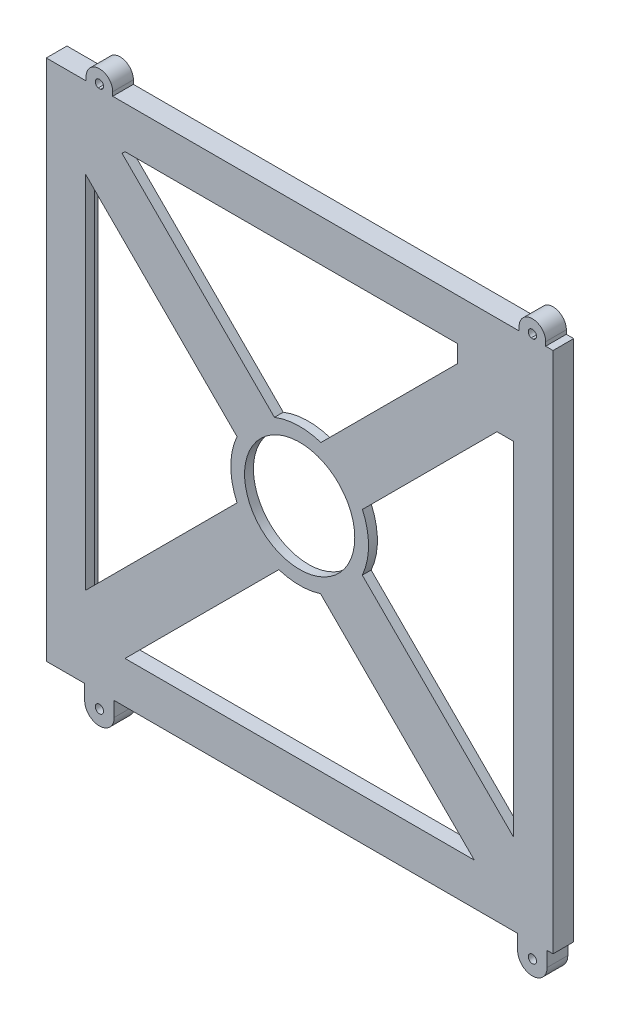
from build123d import *

# Parameters (mm, degrees)
BOSS_EXTRU_1_DEPTH      = 5
BOSS_EXTRU_1_2_DEPTH    = 5
BOSS_EXTRU_1_3_DEPTH    = 5
BOSS_EXTRU_1_4_DEPTH    = 5
BOSS_EXTRU_2_DEPTH      = 3
ENL_V_MAT_EXTRU_2_DEPTH = 186.027362841
ESQUISSE4_R             = 1.6
BOSS_EXTRU_3_DEPTH      = 3
BOSS_EXTRU_4_DEPTH      = 183.014563107
BOSS_EXTRU_6_DEPTH      = 169.006591337
BOSS_EXTRU_7_DEPTH      = 174.257281553
BOSS_EXTRU_8_DEPTH      = 177.5
ESQUISSE10_R            = 28
BOSS_EXTRU_9_DEPTH      = 2
BOSS_EXTRU_11_START     = 2.5
ESQUISSE11_W            = 257.5
ESQUISSE11_H            = 265.5
ESQUISSE11_R            = 28
BOSS_EXTRU_11_DEPTH     = 2.5
ESQUISSE12_R            = 2.1
BOSS_EXTRU_12_DEPTH     = 10.5
ESQUISSE13_R            = 5.1
ENL_V_MAT_EXTRU_3_DEPTH = 5
BOSS_EXTRU_13_DEPTH     = 10.5
ESQUISSE15_R            = 5.1
ENL_V_MAT_EXTRU_4_DEPTH = 5
CONG_1_R                = 1


with BuildPart() as part:
    # Esquisse1 → Boss.-Extru.1 (new body)
    with BuildSketch(Plane.XY):
        Polygon((128.75, -132.75), (88.75, -132.75), (88.75, -111.507281553), (108.75, -91.507281553), (128.75, -91.507281553), align=None)
    extrude(amount=BOSS_EXTRU_1_DEPTH)



with BuildPart() as body_2:
    # Esquisse1 → Boss.-Extru.1 2 (new body)
    with BuildSketch(Plane.XY):
        Polygon((128.75, 132.75), (80.256591337, 132.75), (80.256591337, 102.75), (100.256591337, 82.75), (128.75, 82.75), align=None)
    extrude(amount=BOSS_EXTRU_1_2_DEPTH)


with BuildPart() as body_3:
    # Esquisse1 → Boss.-Extru.1 3 (new body)
    with BuildSketch(Plane.XY):
        Polygon((-128.75, -132.75), (-128.75, -91.507281553), (-108.75, -91.507281553), (-88.75, -111.507281553), (-88.75, -132.75), align=None)
    extrude(amount=BOSS_EXTRU_1_3_DEPTH)


with BuildPart() as body_4:
    # Esquisse1 → Boss.-Extru.1 4 (new body)
    with BuildSketch(Plane.XY):
        Polygon((-88.75, 132.75), (-88.75, 111.507281553), (-108.75, 91.507281553), (-128.75, 91.507281553), (-128.75, 132.75), align=None)
    extrude(amount=BOSS_EXTRU_1_4_DEPTH)


with BuildPart() as part_1:
    add(part.part)

    add(body_2.part)  # Boss.-Extru.2 merges body 2

    add(body_3.part)  # Boss.-Extru.2 merges body 3

    add(body_4.part)  # Boss.-Extru.2 merges body 4
    # Esquisse2 → Boss.-Extru.2 (add)
    with BuildSketch(Plane(origin=(0, 0, 0), x_dir=(-1, 0, 0), z_dir=(0, 0, -1))):
        Polygon((-80.256591337, 127.75), (-80.256591337, 132.75), (-128.75, 132.75), (-128.75, 82.75), (-123.75, 82.75), (-123.75, 127.75), align=None)
        Polygon((-123.75, -127.75), (-88.75, -127.75), (-88.75, -132.75), (-128.75, -132.75), (-128.75, -91.507281553), (-123.75, -91.507281553), align=None)
        Polygon((88.75, -127.75), (88.75, -132.75), (128.75, -132.75), (128.75, -91.507281553), (123.75, -91.507281553), (123.75, -127.75), align=None)
        Polygon((128.75, 132.75), (88.75, 132.75), (88.75, 127.75), (123.75, 127.75), (123.75, 91.507281553), (128.75, 91.507281553), align=None)
    extrude(amount=BOSS_EXTRU_2_DEPTH)

    # Esquisse3 → Enlèv. mat.-Extru.2 (cut, through all)
    with BuildSketch(Plane.XY.offset(3)):
        Polygon((110, 82.75), (110, 110), (80.256591337, 110), (80.256591337, 102.75), (100.256591337, 82.75), align=None)
        Polygon((-90.257281553, 110), (-110, 110), (-110, 91.507281553), (-108.75, 91.507281553), align=None)
        Polygon((-110, -110), (-110, -91.507281553), (-108.75, -91.507281553), (-90.257281553, -110), align=None)
        Polygon((110, -91.507281553), (110, -110), (90.257281553, -110), (108.75, -91.507281553), align=None)
    extrude(amount=-ENL_V_MAT_EXTRU_2_DEPTH, mode=Mode.SUBTRACT)

    # Esquisse4 → Boss.-Extru.3 (add)
    with BuildSketch(Plane(origin=(0, 0, 3), x_dir=(-1, 0, 0), z_dir=(0, 0, -1))):
        with Locations(Location((-107.5, 107.5, 0), (0, 0, 180))):
            Circle(ESQUISSE4_R)
        with Locations((-107.5, -107.5)):
            Circle(ESQUISSE4_R)
        with Locations(Location((107.5, -107.5, 0), (0, 0, 180))):
            Circle(ESQUISSE4_R)
        with Locations(Location((107.5, 107.5, 0), (0, 0, 180))):
            Circle(ESQUISSE4_R)
    extrude(amount=BOSS_EXTRU_3_DEPTH)

    # Esquisse5 → Boss.-Extru.4 (add)
    with BuildSketch(Plane.XZ.offset(-91.507281553)):
        Polygon((-123.75, 0), (-110, 0), (-110, 3), (-108.75, 3), (-108.75, 5), (-128.75, 5), (-128.75, -3), (-123.75, -3), align=None)
    extrude(amount=BOSS_EXTRU_4_DEPTH)

    # Esquisse7 → Boss.-Extru.6 (add)
    with BuildSketch(Plane(origin=(-88.75, 0, 0), x_dir=(0, 0, -1), z_dir=(1, 0, 0))):
        Polygon((0, 111.507281553), (0, 127.75), (3, 127.75), (3, 132.75), (-5, 132.75), (-5, 111.507281553), align=None)
    extrude(amount=BOSS_EXTRU_6_DEPTH)

    # Esquisse8 → Boss.-Extru.7 (add)
    with BuildSketch(Plane(origin=(0, -91.507281553, 0), x_dir=(1, 0, 0), z_dir=(0, 1, 0))):
        Polygon((123.75, 0), (110, 0), (110, -3), (108.75, -3), (108.75, -5), (128.75, -5), (128.75, 3), (123.75, 3), align=None)
    extrude(amount=BOSS_EXTRU_7_DEPTH)

    # Esquisse9 → Boss.-Extru.8 (add)
    with BuildSketch(Plane.ZY.offset(-88.75)):
        Polygon((0, -111.507281553), (0, -127.75), (-3, -127.75), (-3, -132.75), (5, -132.75), (5, -111.507281553), align=None)
    extrude(amount=BOSS_EXTRU_8_DEPTH)

    # Esquisse10 → Boss.-Extru.9 (add)
    with BuildSketch(Plane.XY.offset(5)):
        with BuildLine():
            Line((100.256591337, 82.75), (31.902373727, 14.39578239))
            ThreePointArc((31.902373727, 14.39578239), (34.999858189, -0.099633105), (31.819897219, -14.577178773))
            Line((31.819897219, -14.577178773), (108.75, -91.507281553))
            Line((108.75, -91.507281553), (88.75, -111.507281553))
            Line((88.75, -111.507281553), (10.599223862, -33.356505415))
            ThreePointArc((10.599223862, -33.356505415), (0, -35), (-10.599223862, -33.356505415))
            Line((-10.599223862, -33.356505415), (-88.75, -111.507281553))
            Line((-88.75, -111.507281553), (-108.75, -91.507281553))
            Line((-108.75, -91.507281553), (-31.819897219, -14.577178773))
            ThreePointArc((-31.819897219, -14.577178773), (-35, 0), (-31.819897219, 14.577178773))
            Line((-31.819897219, 14.577178773), (-108.75, 91.507281553))
            Line((-108.75, 91.507281553), (-90.257281553, 110))
            Line((-90.257281553, 110), (-12.823491891, 32.566210337))
            ThreePointArc((-12.823491891, 32.566210337), (-1.075408771, 34.983474613), (10.798967391, 33.292376054))
            Line((10.798967391, 33.292376054), (80.256591337, 102.75))
            Line((80.256591337, 102.75), (100.256591337, 82.75))
        make_face()
        Circle(ESQUISSE10_R, mode=Mode.SUBTRACT)
    extrude(amount=-BOSS_EXTRU_9_DEPTH)

    # Esquisse11 → Boss.-Extru.11 (add)
    with BuildSketch(Plane.XY.offset(5).offset(BOSS_EXTRU_11_START)):
        Rectangle(ESQUISSE11_W, ESQUISSE11_H)
        Circle(ESQUISSE11_R, mode=Mode.SUBTRACT)
        with BuildLine():
            Line((80.256591337, 111.507281553), (80.256591337, 102.75))
            Line((80.256591337, 102.75), (10.798967391, 33.292376054))
            ThreePointArc((10.798967391, 33.292376054), (-1.075408771, 34.983474613), (-12.823491891, 32.566210337))
            Line((-12.823491891, 32.566210337), (-90.257281553, 110))
            Line((-90.257281553, 110), (-88.75, 111.507281553))
            Line((-88.75, 111.507281553), (80.256591337, 111.507281553))
        make_face(mode=Mode.SUBTRACT)
        with BuildLine():
            Line((-108.75, 91.507281553), (-31.819897219, 14.577178773))
            ThreePointArc((-31.819897219, 14.577178773), (-35, 0), (-31.819897219, -14.577178773))
            Line((-31.819897219, -14.577178773), (-108.75, -91.507281553))
            Line((-108.75, -91.507281553), (-108.75, 91.507281553))
        make_face(mode=Mode.SUBTRACT)
        with BuildLine():
            Line((-88.75, -111.507281553), (-10.599223862, -33.356505415))
            ThreePointArc((-10.599223862, -33.356505415), (0, -35), (10.599223862, -33.356505415))
            Line((10.599223862, -33.356505415), (88.75, -111.507281553))
            Line((88.75, -111.507281553), (-88.75, -111.507281553))
        make_face(mode=Mode.SUBTRACT)
        with BuildLine():
            Line((108.75, -91.507281553), (31.819897219, -14.577178773))
            ThreePointArc((31.819897219, -14.577178773), (34.999858189, -0.099633105), (31.902373727, 14.39578239))
            Line((31.902373727, 14.39578239), (100.256591337, 82.75))
            Line((100.256591337, 82.75), (108.75, 82.75))
            Line((108.75, 82.75), (108.75, -91.507281553))
        make_face(mode=Mode.SUBTRACT)
    extrude(amount=-BOSS_EXTRU_11_DEPTH)

    # Esquisse12 → Boss.-Extru.12 (add)
    # profile 1 of 2: a face of its own
    with BuildSketch(Plane(origin=(0, 0, -3), x_dir=(-1, 0, 0), z_dir=(0, 0, -1))):
        with BuildLine():
            Line((109.25, -140.25), (109.25, -132.75))
            Line((109.25, -132.75), (94.25, -132.75))
            Line((94.25, -132.75), (94.25, -140.25))
            ThreePointArc((94.25, -140.25), (101.75, -147.75), (109.25, -140.25))
        make_face()
        with Locations((101.75, -140.25)):
            Circle(ESQUISSE12_R, mode=Mode.SUBTRACT)
    # profile 2 of 2: a face of its own
    with BuildSketch(Plane(origin=(0, 0, -3), x_dir=(-1, 0, 0), z_dir=(0, 0, -1))):
        with BuildLine():
            Line((-110.75, -140.25), (-110.75, -132.75))
            Line((-110.75, -132.75), (-125.75, -132.75))
            Line((-125.75, -132.75), (-125.75, -140.25))
            ThreePointArc((-125.75, -140.25), (-118.25, -147.75), (-110.75, -140.25))
        make_face()
        with Locations((-118.25, -140.25)):
            Circle(ESQUISSE12_R, mode=Mode.SUBTRACT)
    extrude(amount=-BOSS_EXTRU_12_DEPTH)

    # Esquisse13 → Enlèv. mat.-Extru.3 (cut)
    with BuildSketch(Plane(origin=(0, 0, -3), x_dir=(-1, 0, 0), z_dir=(0, 0, -1))):
        with Locations((-118.25, -140.25)):
            Circle(ESQUISSE13_R)
        with Locations((101.75, -140.25)):
            Circle(ESQUISSE13_R)
    extrude(amount=-ENL_V_MAT_EXTRU_3_DEPTH, mode=Mode.SUBTRACT)

    # Esquisse14 → Boss.-Extru.13 (add)
    with BuildSketch(Plane(origin=(0, 0, -3), x_dir=(-1, 0, 0), z_dir=(0, 0, -1))):
        with BuildLine():
            Line((95, 134.75), (95, 132.75))
            Line((95, 132.75), (101.109687576, 132.75))
            ThreePointArc((101.109687576, 132.75), (100.51198871, 136.44626886), (103.85, 134.75))
            ThreePointArc((103.85, 134.75), (103.44626886, 133.51198871), (102.390312424, 132.75))
            Line((102.390312424, 132.75), (108.5, 132.75))
            Line((108.5, 132.75), (108.5, 134.75))
            ThreePointArc((108.5, 134.75), (101.75, 141.5), (95, 134.75))
        make_face()
        with BuildLine():
            ThreePointArc((-111.5, 134.75), (-118.25, 141.5), (-125, 134.75))
            Line((-125, 134.75), (-125, 132.75))
            Line((-125, 132.75), (-118.890312424, 132.75))
            ThreePointArc((-118.890312424, 132.75), (-119.48801129, 136.44626886), (-116.15, 134.75))
            ThreePointArc((-116.15, 134.75), (-116.55373114, 133.51198871), (-117.609687576, 132.75))
            Line((-117.609687576, 132.75), (-111.5, 132.75))
            Line((-111.5, 132.75), (-111.5, 134.75))
        make_face()
    extrude(amount=-BOSS_EXTRU_13_DEPTH)

    # Esquisse15 → Enlèv. mat.-Extru.4 (cut)
    with BuildSketch(Plane(origin=(0, 0, -3), x_dir=(-1, 0, 0), z_dir=(0, 0, -1))):
        with Locations((101.75, 134.75)):
            Circle(ESQUISSE15_R)
        with Locations((-118.25, 134.75)):
            Circle(ESQUISSE15_R)
    extrude(amount=-ENL_V_MAT_EXTRU_4_DEPTH, mode=Mode.SUBTRACT)

    # Congé1
    cong_1_edges = [part_1.edges().sort_by_distance(p)[0] for p in [
        (-109.1, 107.5, 0),
        (-109.1, -107.5, 0),
        (109.1, -107.5, 0),
    ]]
    fillet(cong_1_edges, radius=CONG_1_R)


solid = part_1.part
